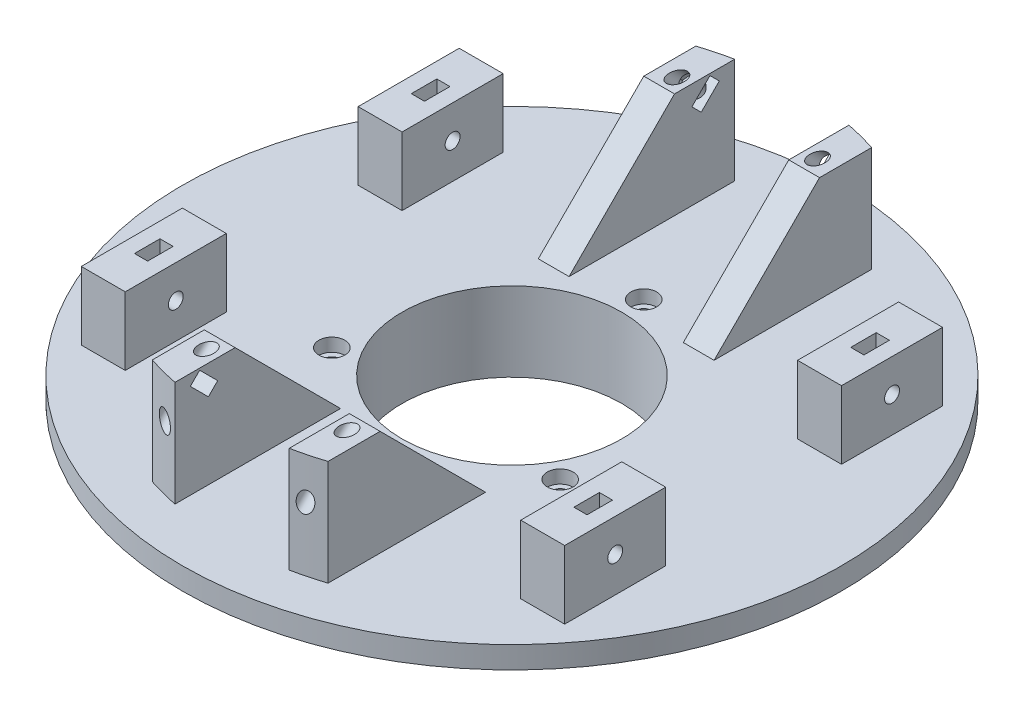
from build123d import *

# Parameters (mm, degrees)
CROQUIS2_W                = 10
CROQUIS2_H                = 23
SALIENTE_EXTRUIR1_DEPTH   = 15.5
CROQUIS3_R                = 1.7
CORTAR_EXTRUIR1_DEPTH     = 15
CORTAR_EXTRUIR2_DEPTH     = 1.5
SIMETR_A2_COPY_1_SKETCH_W = 10
SIMETR_A2_COPY_1_SKETCH_H = 23
SIMETR_A2_COPY_1_DEPTH    = 15.5
SIMETR_A2_COPY_2_SKETCH_R = 1.7
SIMETR_A2_COPY_2_DEPTH    = 15
SIMETR_A2_COPY_3_DEPTH    = 1.5
CROQUIS5_R                = 1.7
CORTAR_EXTRUIR3_DEPTH     = 40.5
CROQUIS6_R                = 2.95
CORTAR_EXTRUIR4_DEPTH     = 3
MATRIZC1_COUNT            = 3
SALIENTE_EXTRUIR2_DEPTH   = 24
CORTAR_EXTRUIR5_DEPTH     = 10
CROQUIS9_R                = 1.7
CORTAR_EXTRUIR6_DEPTH     = 20
CORTAR_EXTRUIR7_DEPTH     = 3
SIMETR_A4_COPY_1_DEPTH    = 24
SIMETR_A4_COPY_2_DEPTH    = 10
SIMETR_A4_COPY_3_SKETCH_R = 1.7
SIMETR_A4_COPY_3_DEPTH    = 20
SIMETR_A4_COPY_4_DEPTH    = 3


with BuildPart() as part:
    # Croquis1 → Revolución1 (revolve)
    with BuildSketch(Plane.XY, mode=Mode.PRIVATE) as revoluci_n1_sk:
        Polygon((25, 0), (25, 18), (75, 18), (75, 13), (47, 13), (47, 6), (35, 6), (35, 0), align=None)
    revolve(revoluci_n1_sk.sketch.rotate(Axis((0, 49.685096011, 0), (0, -1, 0)), 90), axis=Axis((0, 49.685096011, 0), (0, -1, 0)))

    # Croquis2 → Saliente-Extruir1 (add)
    with BuildSketch(Plane(origin=(0, 18, 0), x_dir=(1, 0, 0), z_dir=(0, 1, 0))):
        with Locations((-50, -31.5)):
            Rectangle(CROQUIS2_W, CROQUIS2_H)
    saliente_extruir1 = extrude(amount=SALIENTE_EXTRUIR1_DEPTH)

    # Croquis3 → Cortar-Extruir1 (cut)
    with BuildSketch(Plane.ZY.offset(55)):
        with Locations((31.5, 26)):
            Circle(CROQUIS3_R)
    cortar_extruir1 = extrude(amount=-CORTAR_EXTRUIR1_DEPTH, mode=Mode.SUBTRACT)

    # Croquis4 → Cortar-Extruir2 (cut, symmetric)
    with BuildSketch(Plane.ZY.offset(50)):
        Polygon((28.598814897, 27.175), (28.598814897, 37.175), (34.401185103, 37.175), (34.401185103, 27.175), (34.401185103, 24.325), (31.5, 22.65), (28.598814897, 24.325), align=None)
    cortar_extruir2 = extrude(amount=CORTAR_EXTRUIR2_DEPTH, both=True, mode=Mode.SUBTRACT)

    # Simetría1: Saliente-Extruir1, Cortar-Extruir1, Cortar-Extruir2 across plane
    add(saliente_extruir1.mirror(Plane(origin=(0, 0, 0), x_dir=(0, 0, 1), z_dir=(1, 0, 0))))
    add(cortar_extruir1.mirror(Plane(origin=(0, 0, 0), x_dir=(0, 0, 1), z_dir=(1, 0, 0))), mode=Mode.SUBTRACT)
    add(cortar_extruir2.mirror(Plane(origin=(0, 0, 0), x_dir=(0, 0, 1), z_dir=(1, 0, 0))), mode=Mode.SUBTRACT)

    # Simetría2: Saliente-Extruir1, Cortar-Extruir1, Cortar-Extruir2 across plane
    add(saliente_extruir1.mirror(Plane.XY))
    add(cortar_extruir1.mirror(Plane.XY), mode=Mode.SUBTRACT)
    add(cortar_extruir2.mirror(Plane.XY), mode=Mode.SUBTRACT)

    # Simetría2 copy 1 sketch → Simetría2 copy 1 (add)
    with BuildSketch(Plane(origin=(0, 18, 0), x_dir=(-1, 0, 0), z_dir=(0, 1, 0))):
        with Locations((-50, -31.5)):
            Rectangle(SIMETR_A2_COPY_1_SKETCH_W, SIMETR_A2_COPY_1_SKETCH_H)
    extrude(amount=SIMETR_A2_COPY_1_DEPTH)

    # Simetría2 copy 2 sketch → Simetría2 copy 2 (cut)
    with BuildSketch(Plane(origin=(55, 0, 0), x_dir=(0, 0, -1), z_dir=(1, 0, 0))):
        with Locations((31.5, 26)):
            Circle(SIMETR_A2_COPY_2_SKETCH_R)
    extrude(amount=-SIMETR_A2_COPY_2_DEPTH, mode=Mode.SUBTRACT)

    # Simetría2 copy 3 sketch → Simetría2 copy 3 (cut, symmetric)
    with BuildSketch(Plane(origin=(50, 0, 0), x_dir=(0, 0, -1), z_dir=(1, 0, 0))):
        Polygon((28.598814897, 27.175), (28.598814897, 37.175), (34.401185103, 37.175), (34.401185103, 27.175), (34.401185103, 24.325), (31.5, 22.65), (28.598814897, 24.325), align=None)
    extrude(amount=SIMETR_A2_COPY_3_DEPTH, both=True, mode=Mode.SUBTRACT)

    # Croquis5 → Cortar-Extruir3 (cut)
    with BuildSketch(Plane(origin=(0, 18, 0), x_dir=(1, 0, 0), z_dir=(0, 1, 0))):
        with Locations(Location((0, 30, 0), (0, 0, 270))):
            Circle(CROQUIS5_R)
    cortar_extruir3 = extrude(amount=-CORTAR_EXTRUIR3_DEPTH, mode=Mode.SUBTRACT)

    # Croquis6 → Cortar-Extruir4 (cut)
    with BuildSketch(Plane(origin=(0, 18, 0), x_dir=(1, 0, 0), z_dir=(0, 1, 0))):
        with Locations(Location((0, 30, 0), (0, 0, 270))):
            Circle(CROQUIS6_R)
    cortar_extruir4 = extrude(amount=-CORTAR_EXTRUIR4_DEPTH, mode=Mode.SUBTRACT)

    # MatrizC1: Cortar-Extruir3, Cortar-Extruir4 ×3 about axis
    matrizc1_axis = Axis((0, 0, 0), (0, 1, 0))
    add([cortar_extruir3.rotate(matrizc1_axis, i * 360 / MATRIZC1_COUNT) for i in range(1, MATRIZC1_COUNT)], mode=Mode.SUBTRACT)
    add([cortar_extruir4.rotate(matrizc1_axis, i * 360 / MATRIZC1_COUNT) for i in range(1, MATRIZC1_COUNT)], mode=Mode.SUBTRACT)

    # Croquis7 → Saliente-Extruir2 (add)
    with BuildSketch(Plane(origin=(0, 18, 0), x_dir=(1, 0, 0), z_dir=(0, 1, 0))):
        with BuildLine():
            Line((13, 63.686733312), (13, 26))
            Line((13, 26), (20, 26))
            Line((20, 26), (20, 61.846584384))
            ThreePointArc((20, 61.846584384), (16.525632727, 62.864166764), (13, 63.686733312))
        make_face()
    saliente_extruir2 = extrude(amount=SALIENTE_EXTRUIR2_DEPTH)

    # Croquis8 → Cortar-Extruir5 (cut)
    with BuildSketch(Plane.ZY.offset(-13)):
        Polygon((-26, 18), (-71, 63), (-26, 63), align=None)
    cortar_extruir5 = extrude(amount=-CORTAR_EXTRUIR5_DEPTH, mode=Mode.SUBTRACT)

    # Croquis9 → Cortar-Extruir6 (cut)
    with BuildSketch(Plane(origin=(0, -4, -4), x_dir=(1, 0, 0), z_dir=(0, 0.7071067811865513, 0.7071067811865438))):
        with Locations(Location((16, 67.553823869, 0), (0, 0, 270))):
            Circle(CROQUIS9_R)
    cortar_extruir6 = extrude(amount=-CORTAR_EXTRUIR6_DEPTH, mode=Mode.SUBTRACT)

    # Croquis10 → Cortar-Extruir7 (cut)
    with BuildSketch(Plane(origin=(0, -10.363961031, -10.363961031), x_dir=(1, 0, 0), z_dir=(0, 0.7071067811865513, 0.7071067811865438))):
        Polygon((17.675, 64.652638766), (19.35, 67.553823869), (17.675, 70.455008972), (14.325, 70.455008972), (7.675, 70.455008972), (7.675, 64.652638766), (14.325, 64.652638766), align=None)
    cortar_extruir7 = extrude(amount=CORTAR_EXTRUIR7_DEPTH, mode=Mode.SUBTRACT)

    # Simetría3: Saliente-Extruir2, Cortar-Extruir5, Cortar-Extruir6, Cortar-Extruir7 across plane
    add(saliente_extruir2.mirror(Plane(origin=(0, 0, 0), x_dir=(0, 0, 1), z_dir=(1, 0, 0))))
    add(cortar_extruir5.mirror(Plane(origin=(0, 0, 0), x_dir=(0, 0, 1), z_dir=(1, 0, 0))), mode=Mode.SUBTRACT)
    add(cortar_extruir6.mirror(Plane(origin=(0, 0, 0), x_dir=(0, 0, 1), z_dir=(1, 0, 0))), mode=Mode.SUBTRACT)
    add(cortar_extruir7.mirror(Plane(origin=(0, 0, 0), x_dir=(0, 0, 1), z_dir=(1, 0, 0))), mode=Mode.SUBTRACT)

    # Simetría4: Saliente-Extruir2, Cortar-Extruir5, Cortar-Extruir6, Cortar-Extruir7 across plane
    add(saliente_extruir2.mirror(Plane.XY))
    add(cortar_extruir5.mirror(Plane.XY), mode=Mode.SUBTRACT)
    add(cortar_extruir6.mirror(Plane.XY), mode=Mode.SUBTRACT)
    add(cortar_extruir7.mirror(Plane.XY), mode=Mode.SUBTRACT)

    # Simetría4 copy 1 sketch → Simetría4 copy 1 (add)
    with BuildSketch(Plane(origin=(0, 18, 0), x_dir=(-1, 0, 0), z_dir=(0, 1, 0))):
        with BuildLine():
            Line((13, 63.686733312), (13, 26))
            Line((13, 26), (20, 26))
            Line((20, 26), (20, 61.846584384))
            ThreePointArc((20, 61.846584384), (16.525632727, 62.864166764), (13, 63.686733312))
        make_face()
    extrude(amount=SIMETR_A4_COPY_1_DEPTH)

    # Simetría4 copy 2 sketch → Simetría4 copy 2 (cut)
    with BuildSketch(Plane(origin=(-13, 0, 0), x_dir=(0, 0, -1), z_dir=(1, 0, 0))):
        Polygon((-26, 18), (-71, 63), (-26, 63), align=None)
    extrude(amount=-SIMETR_A4_COPY_2_DEPTH, mode=Mode.SUBTRACT)

    # Simetría4 copy 3 sketch → Simetría4 copy 3 (cut)
    with BuildSketch(Plane(origin=(0, -4, 4), x_dir=(-1, 0, 0), z_dir=(0, 0.7071067811865513, -0.7071067811865438))):
        with Locations(Location((16, 67.553823869, 0), (0, 0, 270))):
            Circle(SIMETR_A4_COPY_3_SKETCH_R)
    extrude(amount=-SIMETR_A4_COPY_3_DEPTH, mode=Mode.SUBTRACT)

    # Simetría4 copy 4 sketch → Simetría4 copy 4 (cut)
    with BuildSketch(Plane(origin=(0, -10.363961031, 10.363961031), x_dir=(-1, 0, 0), z_dir=(0, 0.7071067811865513, -0.7071067811865438))):
        Polygon((17.675, 64.652638766), (19.35, 67.553823869), (17.675, 70.455008972), (14.325, 70.455008972), (7.675, 70.455008972), (7.675, 64.652638766), (14.325, 64.652638766), align=None)
    extrude(amount=SIMETR_A4_COPY_4_DEPTH, mode=Mode.SUBTRACT)


solid = part.part
